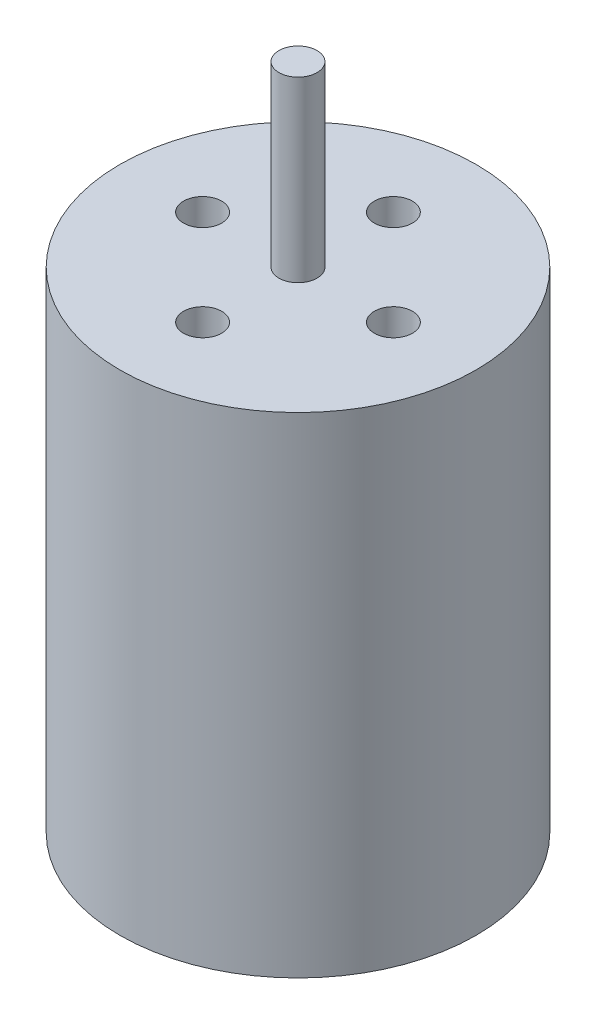
from build123d import *

# Parameters (mm, degrees)
SKETCH2_R          = 1.5
CUT_EXTRUDE1_DEPTH = 3


with BuildPart() as part:
    # Sketch1 → Revolve1 (revolve)
    with BuildSketch(Plane.XY, mode=Mode.PRIVATE) as revolve1_sk:
        Polygon((0, -27.5), (4.4, -27.5), (4.4, -25), (14, -25), (14, 13.5), (1.5, 13.5), (1.5, 27.5), (0, 27.5), align=None)
    revolve(revolve1_sk.sketch.rotate(Axis((0, -23.467413442, 0), (0, 1, 0)), 90), axis=Axis((0, -23.467413442, 0), (0, 1, 0)))

    # Sketch2 → Cut-Extrude1 (cut)
    with BuildSketch(Plane(origin=(0, 13.5, 0), x_dir=(1, 0, 0), z_dir=(0, 1, 0))):
        with Locations(Location((-7.5, 0, 0), (0, 0, 270))):
            Circle(SKETCH2_R)
        with Locations(Location((0, -7.5, 0), (0, 0, 270))):
            Circle(SKETCH2_R)
        with Locations(Location((7.5, 0, 0), (0, 0, 270))):
            Circle(SKETCH2_R)
        with Locations(Location((0, 7.5, 0), (0, 0, 270))):
            Circle(SKETCH2_R)
    extrude(amount=-CUT_EXTRUDE1_DEPTH, mode=Mode.SUBTRACT)


solid = part.part
